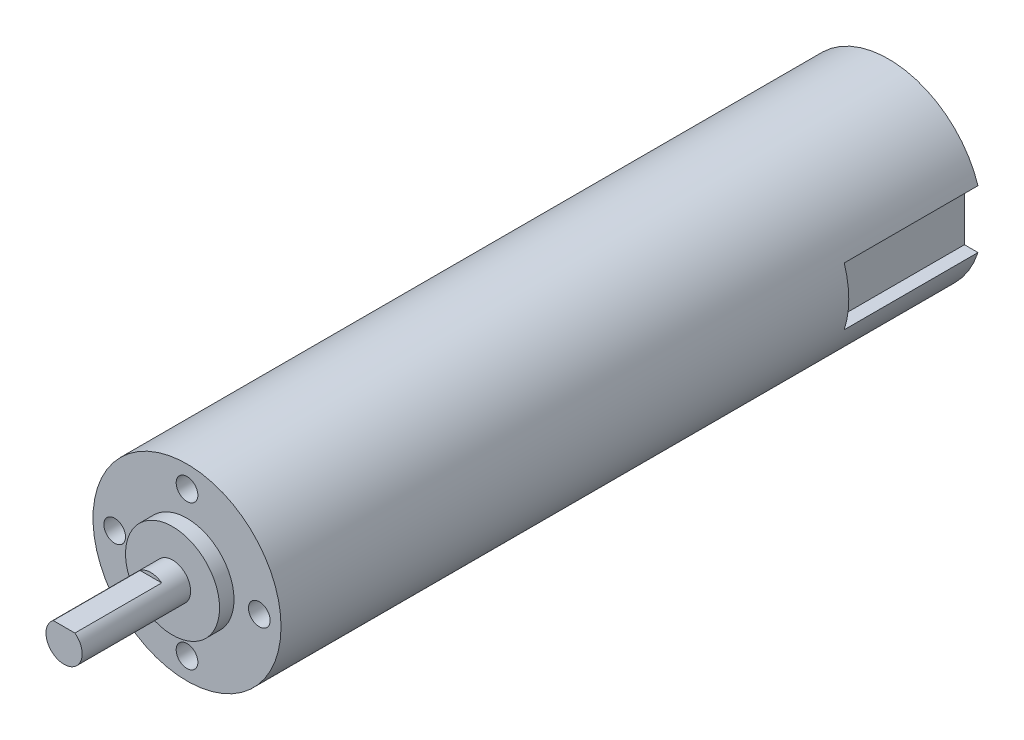
from build123d import *

# Parameters (mm, degrees)
ESQUISSE1_R             = 13
BOSS_EXTRU_1_DEPTH      = 97
ESQUISSE2_R             = 2.5
BOSS_EXTRU_2_DEPTH      = 17
ENL_V_MAT_EXTRU_1_DEPTH = 18.5
ESQUISSE4_R             = 6.5
ESQUISSE4_R_2           = 2.5
BOSS_EXTRU_3_DEPTH      = 2
ESQUISSE5_R             = 1.5
ENL_V_MAT_EXTRU_2_DEPTH = 4
ENL_V_START             = -12
ENL_V_MAT_EXTRU_3_DEPTH = 12


with BuildPart() as part:
    # Esquisse1 → Boss.-Extru.1 (new body)
    with BuildSketch(Plane.XY):
        with Locations(Location((0, 0, 0), (0, 0, 180))):
            Circle(ESQUISSE1_R)
    extrude(amount=BOSS_EXTRU_1_DEPTH)

    # Esquisse2 → Boss.-Extru.2 (add)
    with BuildSketch(Plane.XY.offset(97)):
        Circle(ESQUISSE2_R)
    extrude(amount=BOSS_EXTRU_2_DEPTH)

    # Esquisse3 → Enlèv. mat.-Extru.1 (cut)
    with BuildSketch(Plane(origin=(0, 0, 0), x_dir=(-1, 0, 0), z_dir=(0, 0, -1))):
        with BuildLine():
            Line((-10.5, 0), (-10.5, 4))
            Line((-10.5, 4), (-12.369316877, 4))
            ThreePointArc((-12.369316877, 4), (-13, 0), (-12.369316877, -4))
            Line((-12.369316877, -4), (-10.5, -4))
            Line((-10.5, -4), (-10.5, 0))
        make_face()
        with BuildLine():
            Line((10.5, 0), (10.5, 4))
            Line((10.5, 4), (12.369316877, 4))
            ThreePointArc((12.369316877, 4), (12.99999812, -0.006990598), (12.365007817, -4.013300596))
            Line((12.365007817, -4.013300596), (10.5, -4))
            Line((10.5, -4), (10.5, 0))
        make_face()
    extrude(amount=-ENL_V_MAT_EXTRU_1_DEPTH, mode=Mode.SUBTRACT)

    # Esquisse4 → Boss.-Extru.3 (add)
    with BuildSketch(Plane.XY.offset(97)):
        Circle(ESQUISSE4_R)
        Circle(ESQUISSE4_R_2, mode=Mode.SUBTRACT)
    extrude(amount=BOSS_EXTRU_3_DEPTH)

    # Esquisse5 → Enlèv. mat.-Extru.2 (cut)
    with BuildSketch(Plane.XY.offset(97)):
        with Locations((0, 10)):
            Circle(ESQUISSE5_R)
        with Locations((-10, 0)):
            Circle(ESQUISSE5_R)
        with Locations((0, -10)):
            Circle(ESQUISSE5_R)
        with Locations((10, 0)):
            Circle(ESQUISSE5_R)
    extrude(amount=-ENL_V_MAT_EXTRU_2_DEPTH, mode=Mode.SUBTRACT)

    # Esquisse6 → Enlèv. mat.-Extru.3 (cut)
    with BuildSketch(Plane.XY.offset(114).offset(ENL_V_START)):
        with BuildLine():
            Line((0, 2), (1.5, 2))
            ThreePointArc((1.5, 2), (0, 2.5), (-1.5, 2))
            Line((-1.5, 2), (0, 2))
        make_face()
    extrude(amount=ENL_V_MAT_EXTRU_3_DEPTH, mode=Mode.SUBTRACT)


solid = part.part
